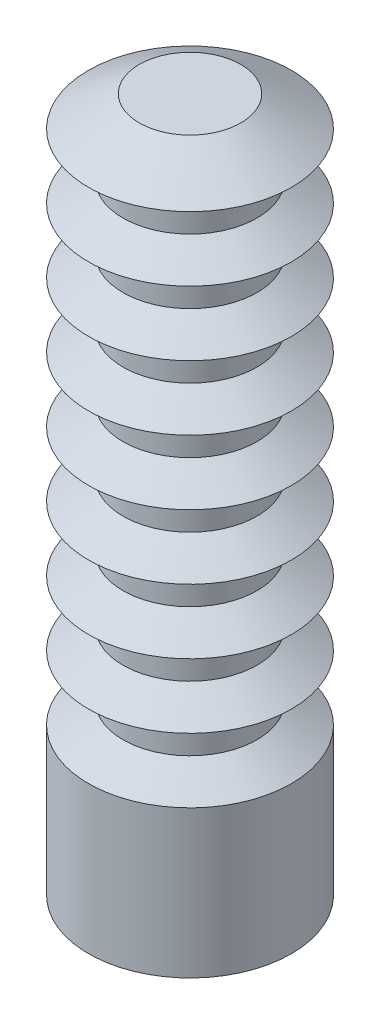
from build123d import *


with BuildPart() as part:
    # Sketch1 → Revolve6 (revolve)
    with BuildSketch(Plane.XY, mode=Mode.PRIVATE) as revolve6_sk:
        Polygon((-0.431630681, 32.7), (-2.131630681, 31.68), (-2.131630681, 30.54), (-0.431630681, 29.52), (-2.131630681, 28.5), (-2.131630681, 27.36), (-0.431630681, 26.34), (-2.131630681, 25.32), (-2.131630681, 24.18), (-0.431630681, 23.16), (-2.131630681, 22.14), (-2.131630681, 21), (-0.431630681, 19.98), (-2.131630681, 18.96), (-2.131630681, 17.82), (-0.431630681, 16.8), (-2.131630681, 15.78), (-2.131630681, 14.64), (-0.431630681, 13.62), (-2.131630681, 12.6), (-2.131630681, 11.46), (-0.431630681, 10.44), (-2.131630681, 9.42), (-2.131630681, 8.28), (-0.431630681, 7.26), (-0.431630681, 0), (-1.231630681, 0), (-1.231630681, 6.795995819), (-1.995791511, 7.26), (-3.138866015, 7.96), (-3.138866015, 9.754155298), (-1.995791511, 10.44), (-3.138866015, 11.14), (-3.138866015, 12.934155298), (-1.995791511, 13.62), (-3.138866015, 14.32), (-3.138866015, 16.114155298), (-1.995791511, 16.8), (-3.138866015, 17.5), (-3.138866015, 19.294155298), (-1.995791511, 19.98), (-3.138866015, 20.68), (-3.138866015, 22.474155298), (-1.995791511, 23.16), (-3.138866015, 23.86), (-3.138866015, 25.654155298), (-1.995791511, 26.34), (-3.138866015, 27.04), (-3.138866015, 28.834155298), (-1.995791511, 29.52), (-3.138866015, 30.22), (-3.138866015, 32.014155298), (-1.995791511, 32.7), (-3.138866015, 33.4), (-5.431630681, 33.4), (-5.431630681, 34.2), (-2.931630681, 34.2), align=None)
    revolve(revolve6_sk.sketch.rotate(Axis((-5.431630681, 34.2, 0), (0, -1, 0)), 180), axis=Axis((-5.431630681, 34.2, 0), (0, -1, 0)))


solid = part.part
